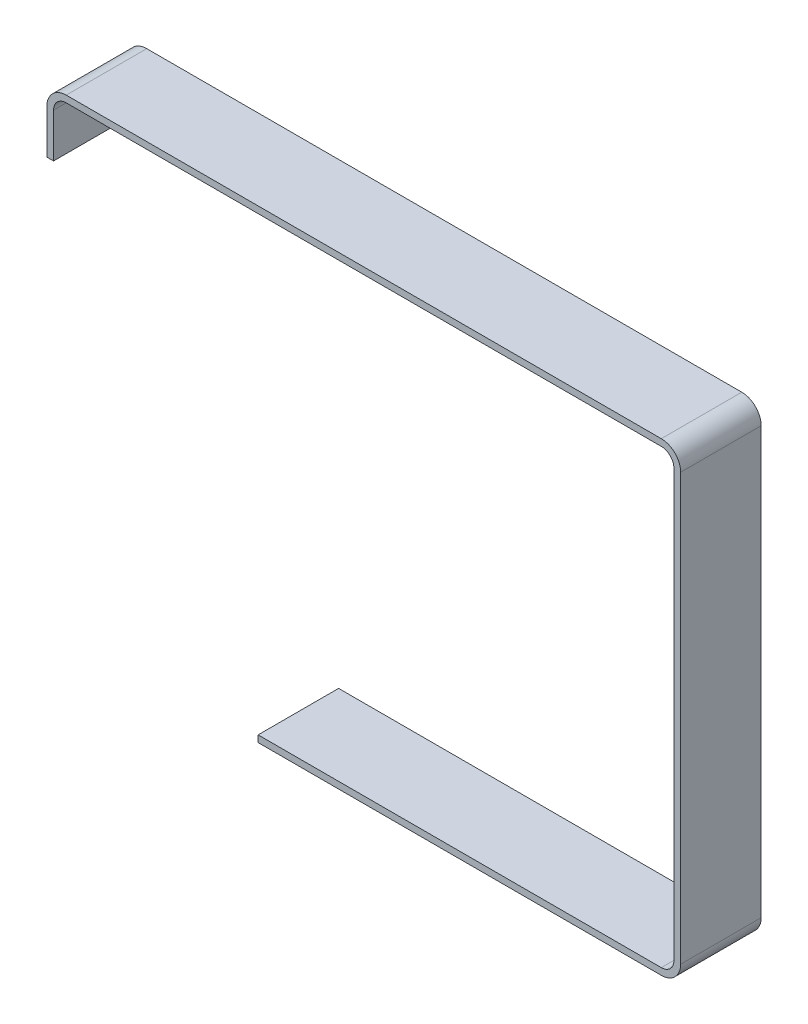
from build123d import *

# Parameters (mm, degrees)
BOSS_EXTRUDE1_DEPTH = 19.05
FILLET1_R           = 3
FILLET2_R           = 4.5875


with BuildPart() as part:
    # Sketch1 → Boss-Extrude1 (new body)
    with BuildSketch(Plane.XY):
        Polygon((-100, 0), (0, 0), (0, 110), (-150, 110), (-150, 95), (-148.4125, 95), (-148.4125, 108.4125), (-1.5875, 108.4125), (-1.5875, 1.5875), (-100, 1.5875), align=None)
    extrude(amount=BOSS_EXTRUDE1_DEPTH)

    # Fillet1
    fillet1_edges = [part.edges().sort_by_distance(p)[0] for p in [
        (-1.5875, 1.5875, 9.525),
        (-1.5875, 108.4125, 9.525),
        (-148.4125, 108.4125, 9.525),
    ]]
    fillet(fillet1_edges, radius=FILLET1_R)

    # Fillet2
    fillet2_edges = [part.edges().sort_by_distance(p)[0] for p in [
        (-150, 110, 9.525),
        (0, 110, 9.525),
        (0, 0, 9.525),
    ]]
    fillet(fillet2_edges, radius=FILLET2_R)


solid = part.part
